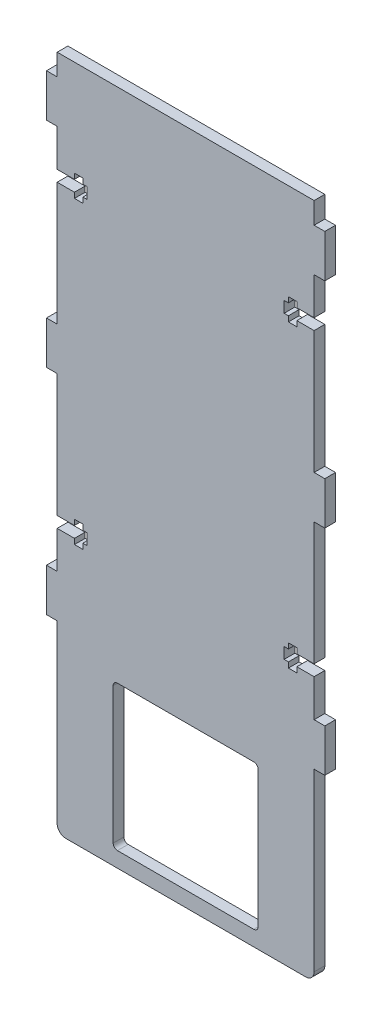
from build123d import *

# Parameters (mm, degrees)
SKETCH1_W           = 76.2
SKETCH1_H           = 152.4
BOSS_EXTRUDE1_DEPTH = 3.175
SKETCH2_W           = 3.175
SKETCH2_H           = 12.7
BOSS_EXTRUDE3_DEPTH = 3.175
SKETCH4_W           = 8.89
SKETCH4_H           = 3.302
SKETCH4_W_2         = 2.5
SKETCH4_H_2         = 6.5
CUT_EXTRUDE4_DEPTH  = 3.175
SKETCH5_W           = 76.2
SKETCH5_H           = 44.45
SKETCH5_W_2         = 43
SKETCH5_H_2         = 43
BOSS_EXTRUDE4_DEPTH = 3.175
SKETCH7_W           = 76.2
SKETCH7_H           = 3.81
BOSS_EXTRUDE5_DEPTH = 3.175
FILLET1_R           = 2.54
FILLET2_R           = 1.27


with BuildPart() as part:
    # Sketch1 → Boss-Extrude1 (new body)
    with BuildSketch(Plane.XY):
        with Locations((38.1, 76.2)):
            Rectangle(SKETCH1_W, SKETCH1_H)
    extrude(amount=BOSS_EXTRUDE1_DEPTH)

    # Sketch2 → Boss-Extrude3 (add)
    with BuildSketch(Plane.XY.offset(3.175)):
        with Locations((-1.5875, 76.2)):
            Rectangle(SKETCH2_W, SKETCH2_H)
        with Locations((77.7875, 139.7)):
            Rectangle(SKETCH2_W, SKETCH2_H)
        with Locations((77.7875, 76.2)):
            Rectangle(SKETCH2_W, SKETCH2_H)
        with Locations((77.7875, 12.7)):
            Rectangle(SKETCH2_W, SKETCH2_H)
        with Locations((-1.5875, 12.7)):
            Rectangle(SKETCH2_W, SKETCH2_H)
        with Locations((-1.5875, 139.7)):
            Rectangle(SKETCH2_W, SKETCH2_H)
    extrude(amount=-BOSS_EXTRUDE3_DEPTH)

    # Sketch4 → Cut-Extrude4 (cut)
    with BuildSketch(Plane.XY.offset(3.175)):
        with Locations((4.445, 120.65)):
            Rectangle(SKETCH4_W, SKETCH4_H)
        with Locations((6.37, 120.65)):
            Rectangle(SKETCH4_W_2, SKETCH4_H_2)
        with Locations((6.37, 31.75)):
            Rectangle(SKETCH4_W_2, SKETCH4_H_2)
        with Locations((4.445, 31.75)):
            Rectangle(SKETCH4_W, SKETCH4_H)
        with Locations((71.755, 31.75)):
            Rectangle(SKETCH4_W, SKETCH4_H)
        with Locations((69.83, 31.75)):
            Rectangle(SKETCH4_W_2, SKETCH4_H_2)
        with Locations((69.83, 120.65)):
            Rectangle(SKETCH4_W_2, SKETCH4_H_2)
        with Locations((71.755, 120.65)):
            Rectangle(SKETCH4_W, SKETCH4_H)
    extrude(amount=-CUT_EXTRUDE4_DEPTH, mode=Mode.SUBTRACT)

    # Sketch5 → Boss-Extrude4 (add)
    with BuildSketch(Plane.XY.offset(3.175)):
        with Locations((38.1, -22.225)):
            Rectangle(SKETCH5_W, SKETCH5_H)
        with Locations((38.1, -22.225)):
            Rectangle(SKETCH5_W_2, SKETCH5_H_2, mode=Mode.SUBTRACT)
    extrude(amount=-BOSS_EXTRUDE4_DEPTH)

    # Sketch7 → Boss-Extrude5 (add)
    with BuildSketch(Plane.XY.offset(3.175)):
        with Locations((38.1, -46.355)):
            Rectangle(SKETCH7_W, SKETCH7_H)
    extrude(amount=-BOSS_EXTRUDE5_DEPTH)

    # Fillet1
    fillet1_edges = [part.edges().sort_by_distance(p)[0] for p in [
        (76.2, -48.26, 1.5875),
        (0, -48.26, 1.5875),
    ]]
    fillet(fillet1_edges, radius=FILLET1_R)

    # Fillet2
    fillet2_edges = [part.edges().sort_by_distance(p)[0] for p in [
        (59.6, -43.725, 1.5875),
        (16.6, -43.725, 1.5875),
        (16.6, -0.725, 1.5875),
        (59.6, -0.725, 1.5875),
    ]]
    fillet(fillet2_edges, radius=FILLET2_R)


solid = part.part
